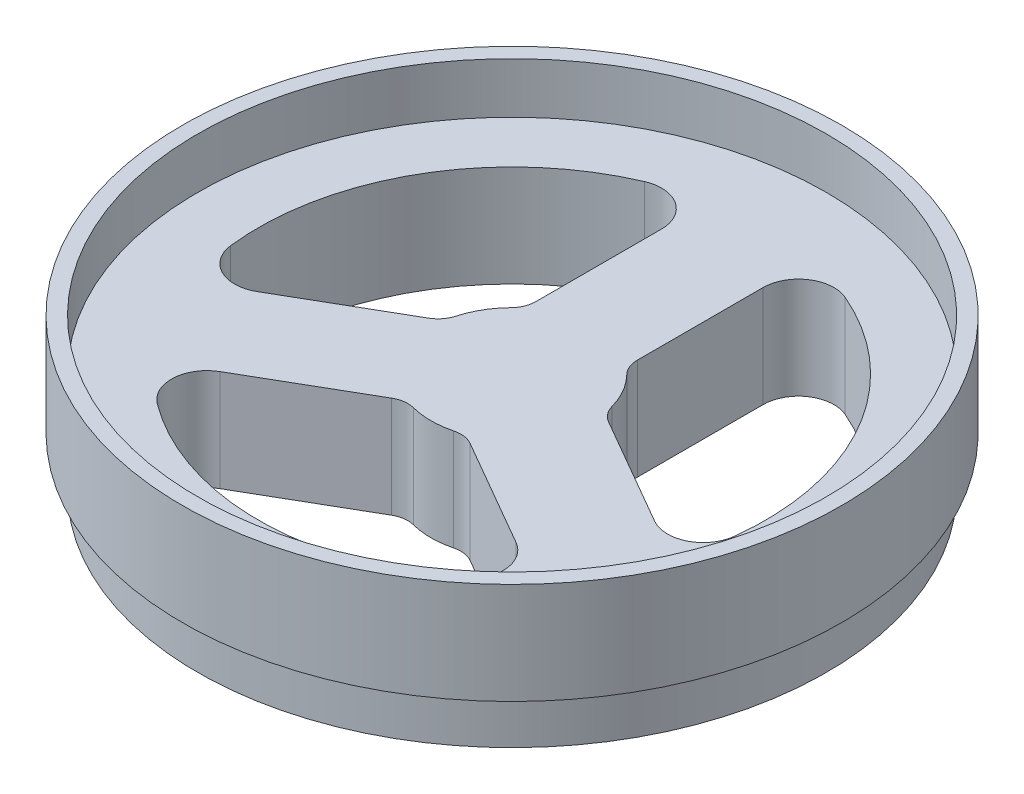
from build123d import *

# Parameters (mm, degrees)
CUT_EXTRUDE1_DEPTH = 20
FILLET1_R          = 5
FILLET2_R          = 7


with BuildPart() as part:
    # Sketch1 → Revolve1 (revolve)
    with BuildSketch(Plane.XY, mode=Mode.PRIVATE) as revolve1_sk:
        Polygon((0, 0), (-62, 0), (-62, 10), (-65, 10), (-65, 30), (-62, 30), (-62, 20), (0, 20), align=None)
    revolve(revolve1_sk.sketch.rotate(Axis((0, 0, 0), (0, 1, 0)), 270), axis=Axis((0, 0, 0), (0, 1, 0)))

    # Szkic1 → Cut-Extrude1 (cut)
    with BuildSketch(Plane(origin=(0, 0, 0), x_dir=(1, 0, 0), z_dir=(0, 1, 0))):
        with BuildLine():
            ThreePointArc((-15.816653826, 2.415256039), (-13.856406461, 8), (-10, 12.489995997))
            Line((-10, 12.489995997), (-10, 48.989794856))
            ThreePointArc((-10, 48.989794856), (-43.301270189, 25), (-47.426406871, -15.83464339))
            Line((-47.426406871, -15.83464339), (-15.816653826, 2.415256039))
        make_face()
        with BuildLine():
            Line((10, 48.989794856), (10, 12.489995997))
            ThreePointArc((10, 12.489995997), (13.856406461, 8), (15.816653826, 2.415256039))
            Line((15.816653826, 2.415256039), (47.426406871, -15.83464339))
            ThreePointArc((47.426406871, -15.83464339), (49.352407963, -8.021211144), (50, 0))
            ThreePointArc((50, 0), (38.729833462, 31.622776602), (10, 48.989794856))
        make_face()
        with BuildLine():
            ThreePointArc((5.816653826, -14.905252036), (0, -16), (-5.816653826, -14.905252036))
            Line((-5.816653826, -14.905252036), (-37.426406871, -33.155151466))
            ThreePointArc((-37.426406871, -33.155151466), (0, -50), (37.426406871, -33.155151466))
            Line((37.426406871, -33.155151466), (5.816653826, -14.905252036))
        make_face()
    extrude(amount=CUT_EXTRUDE1_DEPTH, mode=Mode.SUBTRACT)

    # Fillet1
    fillet1_edges = [part.edges().sort_by_distance(p)[0] for p in [
        (10, 10, -12.489995997),
        (15.816653826, 10, -2.415256039),
        (5.816653826, 10, 14.905252036),
        (-5.816653826, 10, 14.905252036),
        (-15.816653826, 10, -2.415256039),
        (-10, 10, -12.489995997),
    ]]
    fillet(fillet1_edges, radius=FILLET1_R)

    # Fillet2
    fillet2_edges = [part.edges().sort_by_distance(p)[0] for p in [
        (47.426406871, 10, 15.83464339),
        (10, 10, -48.989794856),
        (-37.426406871, 10, 33.155151466),
        (37.426406871, 10, 33.155151466),
        (-10, 10, -48.989794856),
        (-47.426406871, 10, 15.83464339),
    ]]
    fillet(fillet2_edges, radius=FILLET2_R)


solid = part.part
